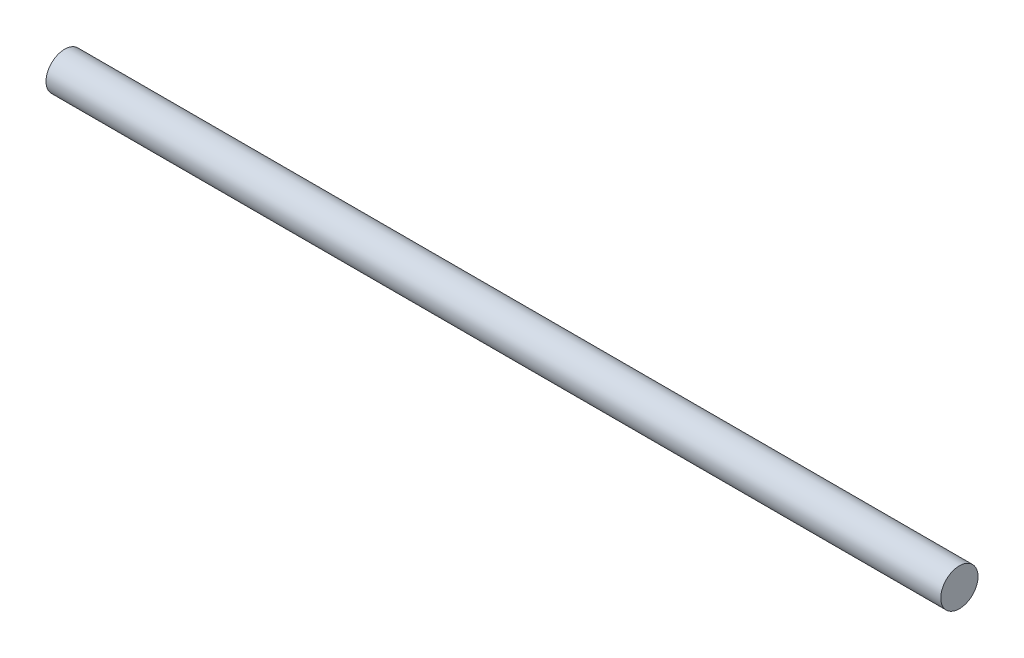
from build123d import *

# Parameters (mm, degrees)
SKETCH1_R           = 3.175
BOSS_EXTRUDE1_DEPTH = 152.4


with BuildPart() as part:
    # Sketch1 → Boss-Extrude1 (new body)
    with BuildSketch(Plane(origin=(0, 0, 0), x_dir=(0, 0, -1), z_dir=(1, 0, 0))):
        with Locations(Location((0, 0, 0), (0, 0, 180))):
            Circle(SKETCH1_R)
    extrude(amount=BOSS_EXTRUDE1_DEPTH)


solid = part.part
